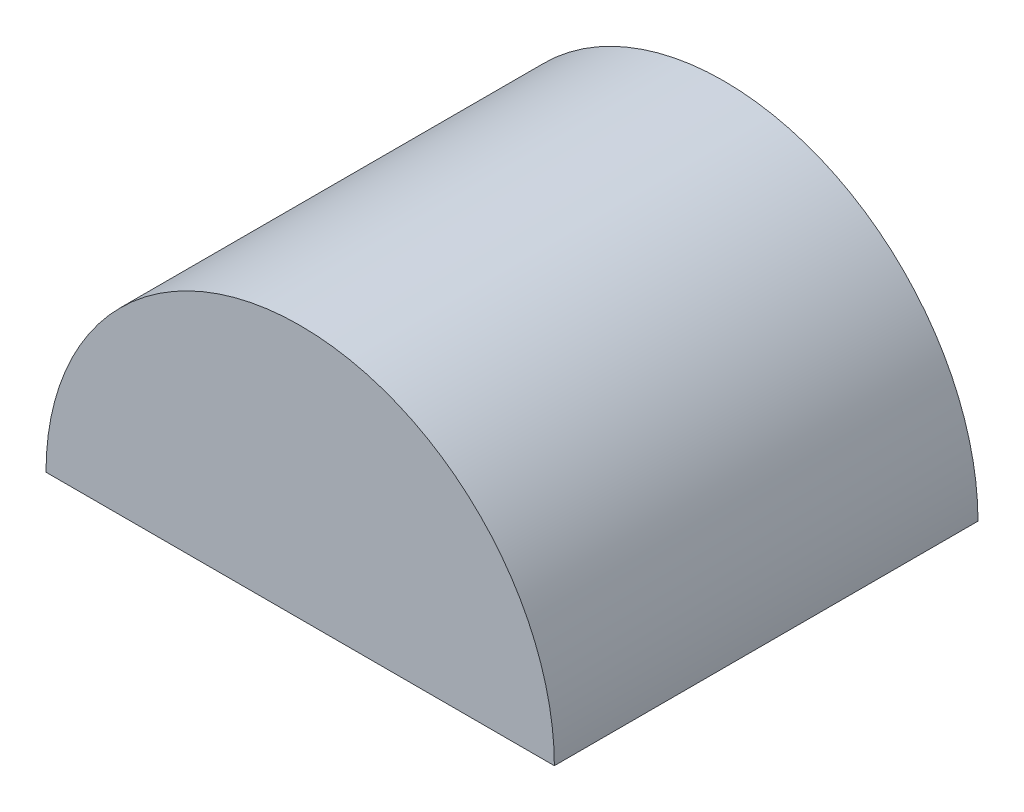
from build123d import *

# Parameters (mm, degrees)
BOSS_EXTRUDE1_DEPTH = 500


with BuildPart() as part:
    # Sketch2 → Boss-Extrude1 (new body)
    with BuildSketch(Plane.XY):
        with BuildLine():
            Line((-300, 0), (300, 0))
            ThreePointArc((300, 0), (0, 300), (-300, 0))
        make_face()
    extrude(amount=BOSS_EXTRUDE1_DEPTH)


solid = part.part
